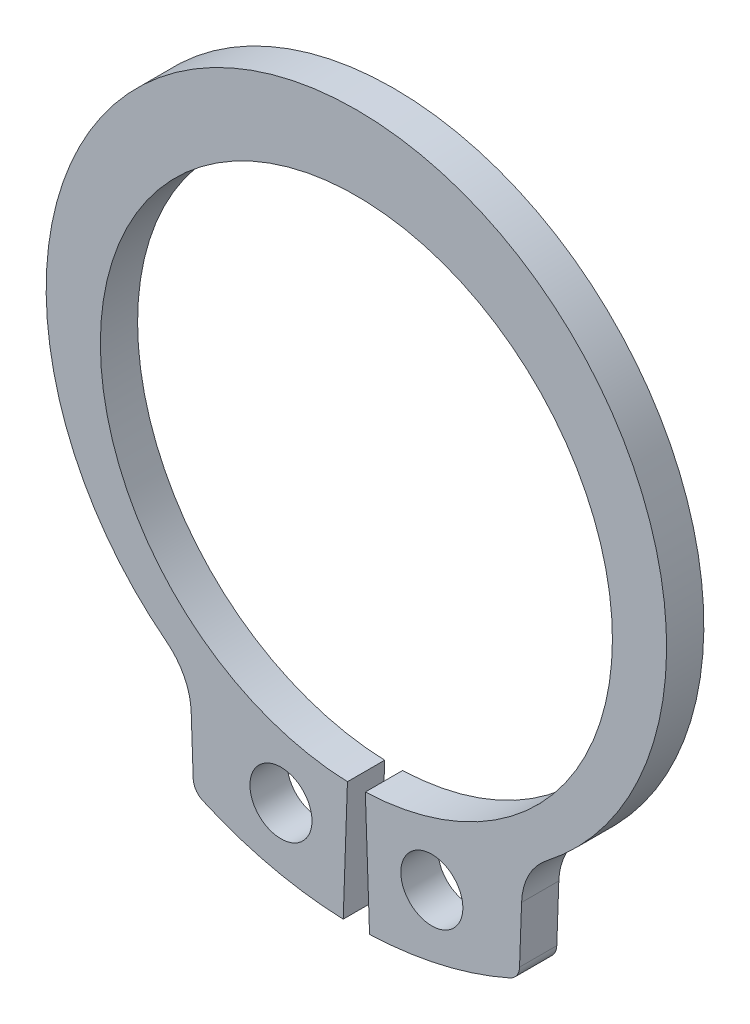
from build123d import *

# Parameters (mm, degrees)
SKETCH1_R            = 1
BOSS_EXTRUDE1_DEPTH  = 1.2
FILLET1_R            = 2.07
FILLET4_R            = 0.52
FILLET1_OF_MIRROR1_R = 2.07
FILLET4_OF_MIRROR1_R = 0.52


with BuildPart() as part:
    # Sketch1 → Boss-Extrude1 (new body)
    with BuildSketch(Plane.XY):
        with BuildLine():
            Line((0, 10.716160966), (0, 8.316160966))
            ThreePointArc((0, 8.316160966), (-8.248743485, 0.21014332), (-0.287920848, -8.178813356))
            Line((-0.287920848, -8.178813356), (-0.424287349, -12.083839034))
            ThreePointArc((-0.424287349, -12.083839034), (-2.896253939, -11.741219474), (-5.246180053, -10.901068155))
            Line((-5.246180053, -10.901068155), (-5.359136951, -7.71729271))
            ThreePointArc((-5.359136951, -7.71729271), (-9.598340525, 3.51092083), (0, 10.716160966))
        make_face()
        with Locations((-2.430824062, -9.84376582)):
            Circle(SKETCH1_R, mode=Mode.SUBTRACT)
    boss_extrude1 = extrude(amount=BOSS_EXTRUDE1_DEPTH)

    # Fillet1
    fillet1_edges = [part.edges().sort_by_distance(p)[0] for p in [
        (-5.359136951, -7.71729271, 0.6),
    ]]
    fillet(fillet1_edges, radius=FILLET1_R)

    # Fillet4
    fillet4_edges = [part.edges().sort_by_distance(p)[0] for p in [
        (-5.246180053, -10.901068155, 0.6),
    ]]
    fillet(fillet4_edges, radius=FILLET4_R)

    # Mirror1: Boss-Extrude1 across plane
    add(boss_extrude1.mirror(Plane(origin=(0, 10.716160966, 1.2), x_dir=(0, 0, 1), z_dir=(-1, 0, 0))))

    # Fillet1 of Mirror1
    fillet1_of_mirror1_edges = [part.edges().sort_by_distance(p)[0] for p in [
        (5.359136951, -7.71729271, 0.6),
    ]]
    fillet(fillet1_of_mirror1_edges, radius=FILLET1_OF_MIRROR1_R)

    # Fillet4 of Mirror1
    fillet4_of_mirror1_edges = [part.edges().sort_by_distance(p)[0] for p in [
        (5.246180053, -10.901068155, 0.6),
    ]]
    fillet(fillet4_of_mirror1_edges, radius=FILLET4_OF_MIRROR1_R)


solid = part.part
